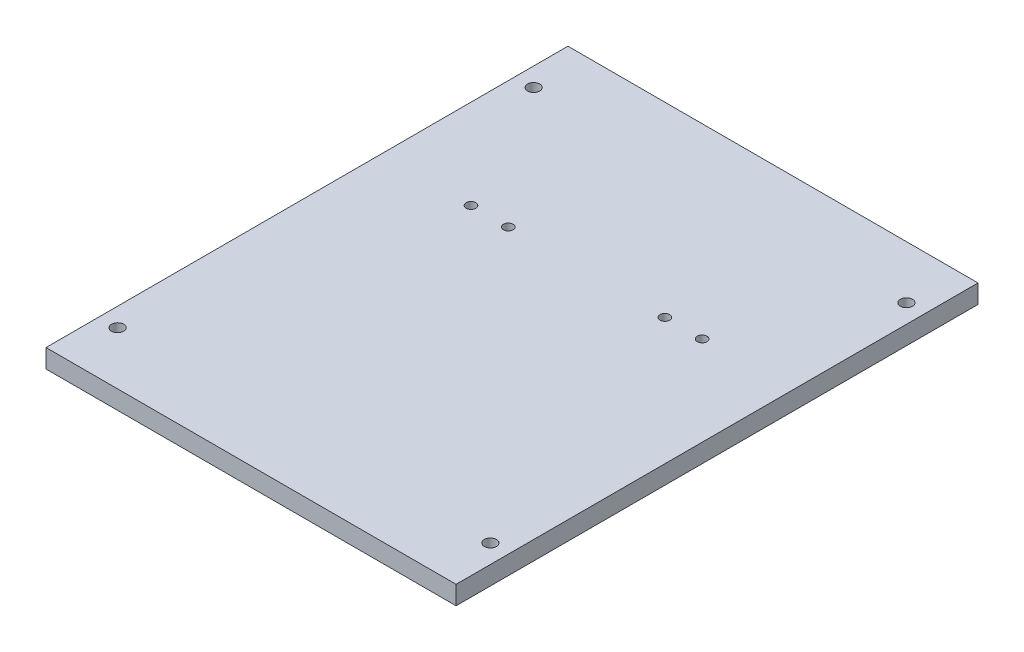
from build123d import *

# Parameters (mm, degrees)
SKETCH1_W           = 139.7
SKETCH1_H           = 177.8
SKETCH1_R           = 2.0828
SKETCH1_R_2         = 1.651
BOSS_EXTRUDE1_DEPTH = 6.35


with BuildPart() as part:
    # Sketch1 → Boss-Extrude1 (new body)
    with BuildSketch(Plane(origin=(0, 0, 0), x_dir=(1, 0, 0), z_dir=(0, 1, 0))):
        with Locations((69.85, 101.6)):
            Rectangle(SKETCH1_W, SKETCH1_H)
        with Locations(Location((133.35, 172.466, 0), (0, 0, 270))):
            Circle(SKETCH1_R, mode=Mode.SUBTRACT)
        with Locations(Location((133.35, 30.734, 0), (0, 0, 90))):
            Circle(SKETCH1_R, mode=Mode.SUBTRACT)
        with Locations(Location((6.35, 172.466, 0), (0, 0, 90))):
            Circle(SKETCH1_R, mode=Mode.SUBTRACT)
        with Locations(Location((6.35, 30.734, 0), (0, 0, 270))):
            Circle(SKETCH1_R, mode=Mode.SUBTRACT)
        with Locations(Location((43.18, 127, 0), (0, 0, 90))):
            Circle(SKETCH1_R_2, mode=Mode.SUBTRACT)
        with Locations(Location((109.22, 127, 0), (0, 0, 270))):
            Circle(SKETCH1_R_2, mode=Mode.SUBTRACT)
        with Locations(Location((96.52, 127, 0), (0, 0, 270))):
            Circle(SKETCH1_R_2, mode=Mode.SUBTRACT)
        with Locations(Location((30.48, 127, 0), (0, 0, 90))):
            Circle(SKETCH1_R_2, mode=Mode.SUBTRACT)
    extrude(amount=BOSS_EXTRUDE1_DEPTH)


solid = part.part
